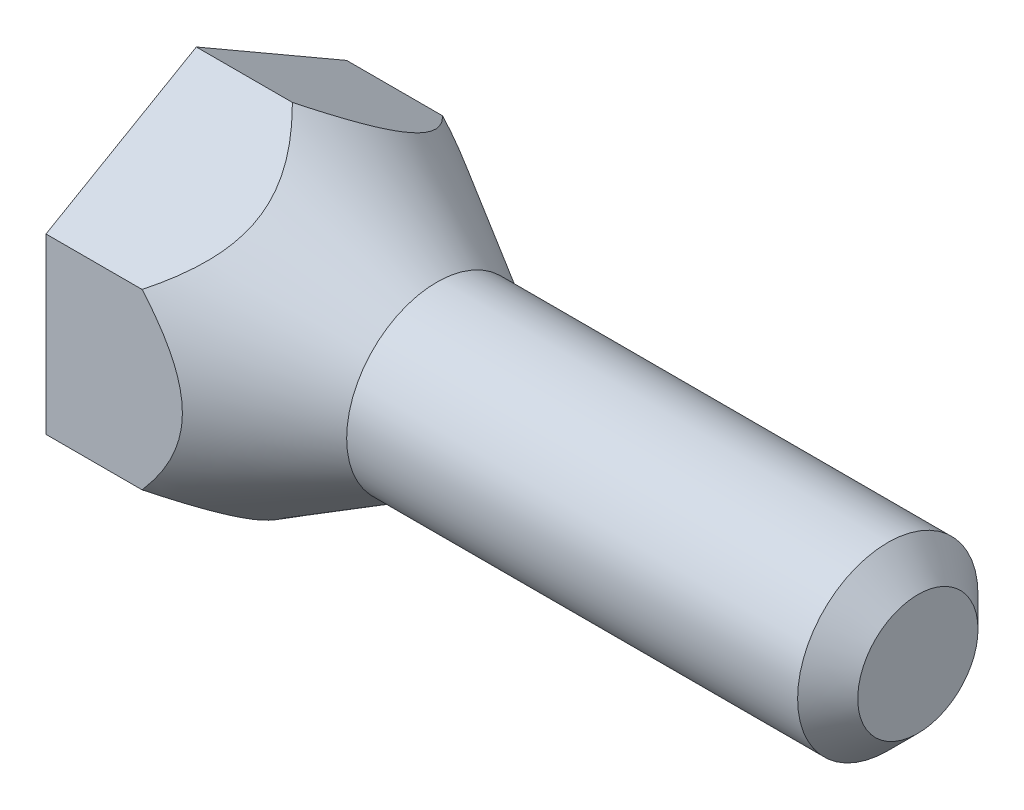
from build123d import *

# Parameters (mm, degrees)
EXTRUDE_1_DEPTH = 24
CHAMFER_1_SIZE  = 1


with BuildPart() as part:
    # Эскиз1 → Бобышка-Вытянуть1 (new body)
    with BuildSketch(Plane(origin=(0, 0, 0), x_dir=(0, 0, -1), z_dir=(1, 0, 0))):
        Polygon((0, 5.773502692), (-5, 2.886751346), (-5, -2.886751346), (0, -5.773502692), (5, -2.886751346), (5, 2.886751346), align=None)
    extrude(amount=EXTRUDE_1_DEPTH)

    # Эскиз2 → Вырез-Повернуть1 (revolve, cut)
    with BuildSketch(Plane.XY, mode=Mode.PRIVATE) as cut_revolve_1_sk:
        Polygon((3.196152423, 5.773502692), (8, 3), (24, 3), (24, 5.773502692), align=None)
    revolve(cut_revolve_1_sk.sketch.rotate(Axis((0, 0, 0), (1, 0, 0)), 90), axis=Axis((0, 0, 0), (1, 0, 0)), mode=Mode.SUBTRACT)

    # Фаска1
    chamfer_1_edges = [part.edges().sort_by_distance(p)[0] for p in [
        (24, 0, -3),
    ]]
    chamfer(chamfer_1_edges, length=CHAMFER_1_SIZE)


solid = part.part
